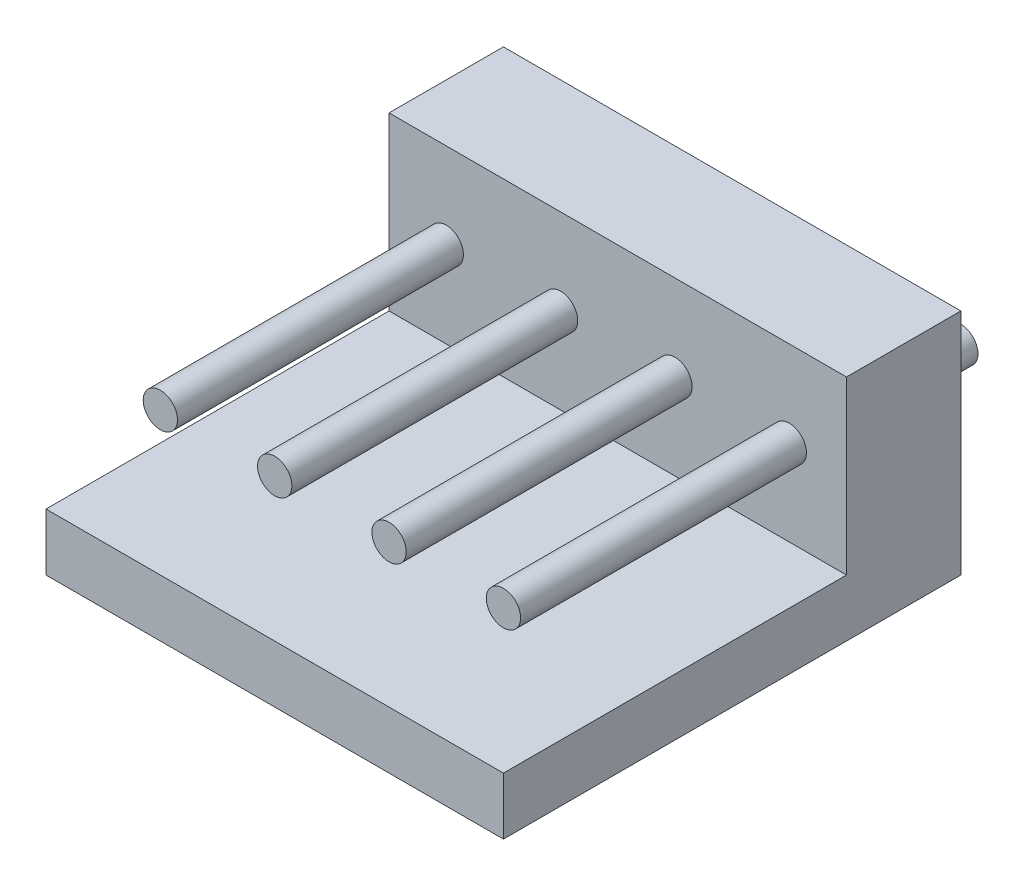
from build123d import *

# Parameters (mm, degrees)
SKETCH_1_W           = 20
SKETCH_1_H           = 10
EXTRUDE_1_DEPTH      = 5
SKETCH_2_W           = 20
SKETCH_2_H           = 2.5
EXTRUDE_2_DEPTH      = 15
EXTRUDE_3_DEPTH      = 12.5
EXTRUDE_3_DEPTH_BACK = 7.5
SKETCH_3_R           = 0.75


with BuildPart() as part:
    # Эскиз1 → Вытянуть1 (new body)
    with BuildSketch(Plane.XY):
        with Locations((10, 5)):
            Rectangle(SKETCH_1_W, SKETCH_1_H)
    extrude(amount=EXTRUDE_1_DEPTH)

    # Эскиз2 → Вытянуть2 (add)
    with BuildSketch(Plane.XY.offset(5)):
        with Locations((10, 1.25)):
            Rectangle(SKETCH_2_W, SKETCH_2_H)
    extrude(amount=EXTRUDE_2_DEPTH)

    # Эскиз3 → Вытянуть3 (add, two sides: drawn at the far end of the back side and taken through both)
    with BuildSketch(Plane.XY.offset(5).offset(-EXTRUDE_3_DEPTH_BACK)):
        with Locations((12.5, 6.25)):
            Circle(SKETCH_3_R)
        with Locations((17.5, 6.25)):
            Circle(SKETCH_3_R)
        with Locations((2.5, 6.25)):
            Circle(SKETCH_3_R)
        with Locations((7.5, 6.25)):
            Circle(SKETCH_3_R)
    extrude(amount=EXTRUDE_3_DEPTH + EXTRUDE_3_DEPTH_BACK)


solid = part.part
